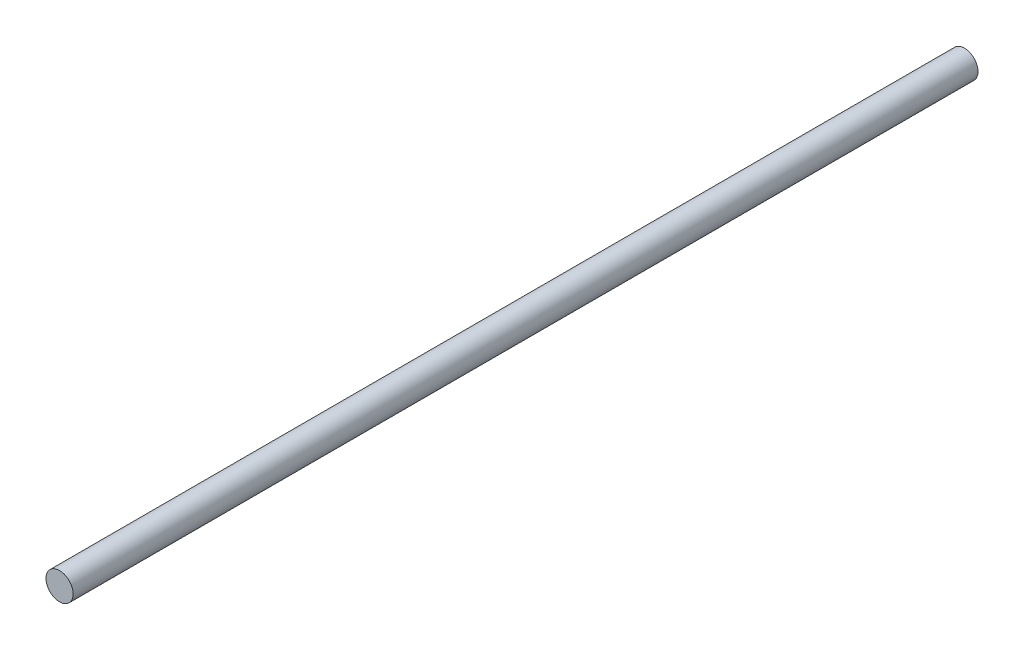
from build123d import *

# Parameters (mm, degrees)
SKETCH2_R           = 1.5
BOSS_EXTRUDE1_DEPTH = 100


with BuildPart() as part:
    # Sketch2 → Boss-Extrude1 (new body)
    with BuildSketch(Plane.XY):
        Circle(SKETCH2_R)
    extrude(amount=BOSS_EXTRUDE1_DEPTH)


solid = part.part
